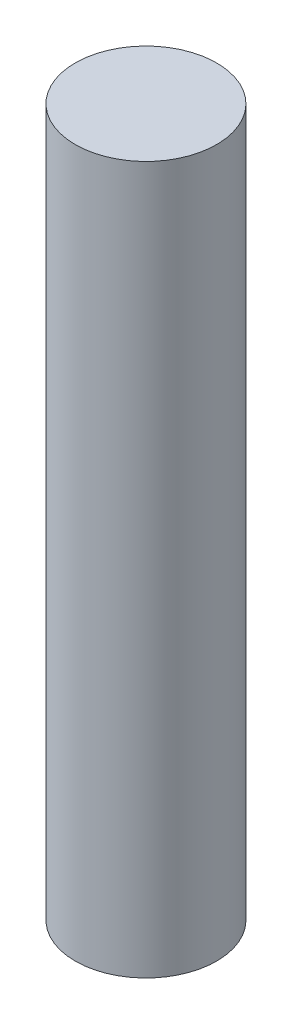
from build123d import *

# Parameters (mm, degrees)
SKETCH1_R           = 0.1
BOSS_EXTRUDE1_DEPTH = 1


with BuildPart() as part:
    # Sketch1 → Boss-Extrude1 (new body)
    with BuildSketch(Plane(origin=(0, 0, 0), x_dir=(1, 0, 0), z_dir=(0, 1, 0))):
        with Locations(Location((0, 0, 0), (0, 0, 270))):
            Circle(SKETCH1_R)
    extrude(amount=BOSS_EXTRUDE1_DEPTH)


solid = part.part
